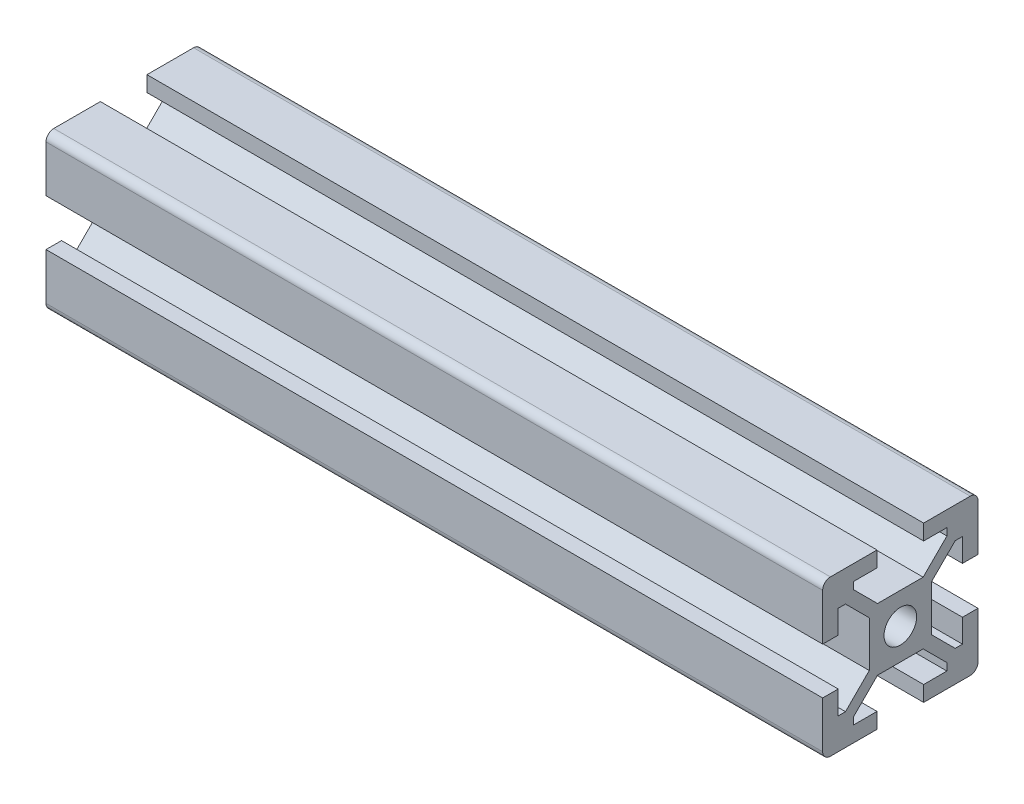
from build123d import *

# Parameters (mm, degrees)
SKETCH1_R           = 2.1
BOSS_EXTRUDE1_DEPTH = 100
SKETCH_1_R          = 2.75
CUT_EXTRUDE_1_DEPTH = 102.469207152
SKETCH_2_R          = 2.75
CUT_EXTRUDE_2_DEPTH = 102.46920725


with BuildPart() as part:
    # Sketch1 → Boss-Extrude1 (new body)
    with BuildSketch(Plane(origin=(0, 0, 0), x_dir=(0, 0, -1), z_dir=(1, 0, 0))):
        with BuildLine():
            Line((-10, 9), (-10, 3))
            Line((-10, 3), (-8, 3))
            Line((-8, 3), (-8, 6))
            Line((-8, 6), (-7.060660172, 6))
            Line((-7.060660172, 6), (-4, 2.939339828))
            Line((-4, 2.939339828), (-4, -2.939339828))
            Line((-4, -2.939339828), (-7.060660172, -6))
            Line((-7.060660172, -6), (-8, -6))
            Line((-8, -6), (-8, -3))
            Line((-8, -3), (-10, -3))
            Line((-10, -3), (-10, -9))
            ThreePointArc((-10, -9), (-9.707106781, -9.707106781), (-9, -10))
            Line((-9, -10), (-3, -10))
            Line((-3, -10), (-3, -8))
            Line((-3, -8), (-6, -8))
            Line((-6, -8), (-6, -7.060660172))
            Line((-6, -7.060660172), (-2.939339828, -4))
            Line((-2.939339828, -4), (2.939339828, -4))
            Line((2.939339828, -4), (6, -7.060660172))
            Line((6, -7.060660172), (6, -8))
            Line((6, -8), (3, -8))
            Line((3, -8), (3, -10))
            Line((3, -10), (9, -10))
            ThreePointArc((9, -10), (9.707106781, -9.707106781), (10, -9))
            Line((10, -9), (10, -3))
            Line((10, -3), (8, -3))
            Line((8, -3), (8, -6))
            Line((8, -6), (7.060660172, -6))
            Line((7.060660172, -6), (4, -2.939339828))
            Line((4, -2.939339828), (4, 2.939339828))
            Line((4, 2.939339828), (7.060660172, 6))
            Line((7.060660172, 6), (8, 6))
            Line((8, 6), (8, 3))
            Line((8, 3), (10, 3))
            Line((10, 3), (10, 9))
            ThreePointArc((10, 9), (9.707106781, 9.707106781), (9, 10))
            Line((9, 10), (3, 10))
            Line((3, 10), (3, 8))
            Line((3, 8), (6, 8))
            Line((6, 8), (6, 7.060660172))
            Line((6, 7.060660172), (2.939339828, 4))
            Line((2.939339828, 4), (-2.939339828, 4))
            Line((-2.939339828, 4), (-6, 7.060660172))
            Line((-6, 7.060660172), (-6, 8))
            Line((-6, 8), (-3, 8))
            Line((-3, 8), (-3, 10))
            Line((-3, 10), (-9, 10))
            ThreePointArc((-9, 10), (-9.707106781, 9.707106781), (-10, 9))
        make_face()
        Circle(SKETCH1_R, mode=Mode.SUBTRACT)
    extrude(amount=BOSS_EXTRUDE1_DEPTH)

    # 草图1 → 切除-拉伸1 (cut, through all)
    with BuildSketch(Plane(origin=(0, 4, 0), x_dir=(1, 0, 0), z_dir=(0, 1, 0))):
        with Locations((41, -0.010660172)):
            Circle(SKETCH_1_R)
    extrude(amount=-CUT_EXTRUDE_1_DEPTH, mode=Mode.SUBTRACT)

    # 草图2 → 切除-拉伸2 (cut, through all)
    with BuildSketch(Plane.XY.offset(4)):
        with Locations((59, -0.05)):
            Circle(SKETCH_2_R)
    extrude(amount=-CUT_EXTRUDE_2_DEPTH, mode=Mode.SUBTRACT)


solid = part.part
